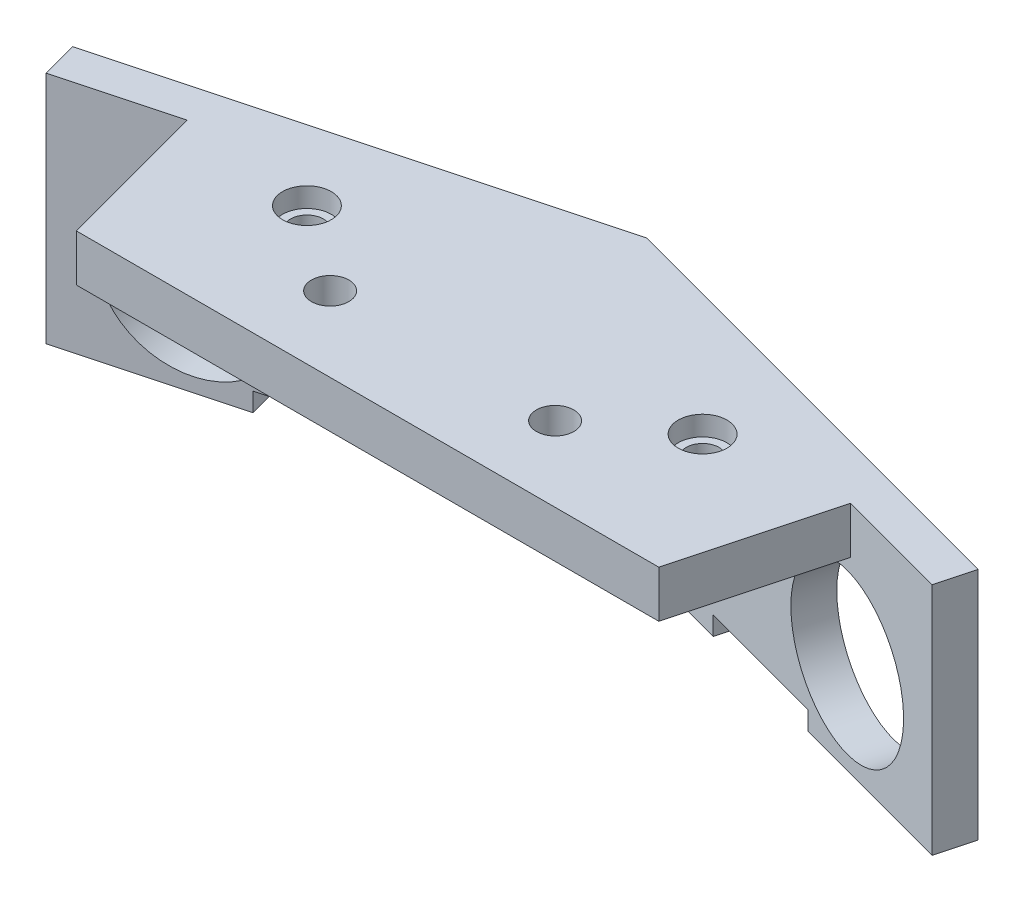
from build123d import *

# Parameters (mm, degrees)
BOSS_EXTRUDE1_DEPTH = 25
SKETCH2_R           = 2
BOSS_EXTRUDE2_DEPTH = 5
SKETCH3_R           = 1.75
CUT_EXTRUDE1_DEPTH  = 5
SKETCH4_R           = 2.6
CUT_EXTRUDE2_DEPTH  = 2.1
BOSS_EXTRUDE4_DEPTH = 1.5
SKETCH6_R           = 8.5
SKETCH6_W           = 11
SKETCH6_H           = 3
CUT_EXTRUDE3_DEPTH  = 62.991888409
SKETCH7_R           = 8.5
SKETCH7_W           = 11
SKETCH7_H           = 4
CUT_EXTRUDE4_DEPTH  = 62.991888409
CUT_EXTRUDE6_DEPTH  = 2
CUT_EXTRUDE7_DEPTH  = 3.5


with BuildPart() as part:
    # Sketch1 → Boss-Extrude1 (new body)
    with BuildSketch(Plane(origin=(0, 0, 0), x_dir=(1, 0, 0), z_dir=(0, 1, 0))):
        Polygon((0, 0), (-48.296291314, -12.940952255), (-47.261015134, -16.80465556), (0, -4.141104722), (47.261015134, -16.80465556), (48.296291314, -12.940952255), align=None)
    extrude(amount=BOSS_EXTRUDE1_DEPTH)

    # Sketch2 → Boss-Extrude2 (add)
    with BuildSketch(Plane(origin=(0, 25, 0), x_dir=(1, 0, 0), z_dir=(0, 1, 0))):
        Polygon((18.842355233, -29.75672149), (-18.842355233, -29.75672149), (-31.057618335, -29.75672149), (-35.381056589, -13.621430262), (0, -4.141104722), (35.381056589, -13.621430262), (31.057618335, -29.75672149), align=None)
        with Locations(Location((-12, -21.75672149, 0), (0, 0, 270))):
            Circle(SKETCH2_R, mode=Mode.SUBTRACT)
        with Locations(Location((12, -21.75672149, 0), (0, 0, 270))):
            Circle(SKETCH2_R, mode=Mode.SUBTRACT)
    extrude(amount=-BOSS_EXTRUDE2_DEPTH)

    # Sketch3 → Cut-Extrude1 (cut)
    with BuildSketch(Plane(origin=(0, 25, 0), x_dir=(1, 0, 0), z_dir=(0, 1, 0))):
        Polygon((24.5917878, -13.318644854), (23.220046861, -18.438051734), (25.345083679, -19.007453633), (26.716824618, -13.888046753), align=None)
        with Locations(Location((21.104732435, -15.127773063, 0), (0, 0, 270))):
            Circle(SKETCH3_R)
        Polygon((18.989418008, -11.817494393), (17.617677069, -16.936901272), (15.492640251, -16.367499373), (16.86438119, -11.248092493), align=None)
        Polygon((-15.492640251, -16.367499373), (-17.617677069, -16.936901272), (-18.989418008, -11.817494393), (-16.86438119, -11.248092493), align=None)
        with Locations(Location((-21.104732435, -15.127773063, 0), (0, 0, 270))):
            Circle(SKETCH3_R)
        Polygon((-25.345083679, -19.007453633), (-26.716824618, -13.888046753), (-24.5917878, -13.318644854), (-23.220046861, -18.438051734), align=None)
    extrude(amount=-CUT_EXTRUDE1_DEPTH, mode=Mode.SUBTRACT)

    # Sketch4 → Cut-Extrude2 (cut)
    with BuildSketch(Plane(origin=(0, 25, 0), x_dir=(1, 0, 0), z_dir=(0, 1, 0))):
        with Locations(Location((-21.104732435, -15.127773063, 0), (0, 0, 270))):
            Circle(SKETCH4_R)
        with Locations(Location((21.104732435, -15.127773063, 0), (0, 0, 270))):
            Circle(SKETCH4_R)
    extrude(amount=-CUT_EXTRUDE2_DEPTH, mode=Mode.SUBTRACT)

    # Sketch5 → Boss-Extrude4 (add)
    with BuildSketch(Plane(origin=(0, 25, 0), x_dir=(1, 0, 0), z_dir=(0, 1, 0))):
        Polygon((-26.716824618, -13.888046753), (-25.345083679, -19.007453633), (-23.220046861, -18.438051734), (-24.5917878, -13.318644854), align=None)
        Polygon((-17.617677069, -16.936901272), (-15.492640251, -16.367499373), (-16.86438119, -11.248092493), (-18.989418008, -11.817494393), align=None)
        Polygon((18.989418008, -11.817494393), (17.617677069, -16.936901272), (15.492640251, -16.367499373), (16.86438119, -11.248092493), align=None)
        Polygon((24.5917878, -13.318644854), (26.716824618, -13.888046753), (25.345083679, -19.007453633), (23.220046861, -18.438051734), align=None)
    extrude(amount=-BOSS_EXTRUDE4_DEPTH)

    # Sketch6 → Cut-Extrude3 (cut, through all)
    with BuildSketch(Plane(origin=(0, 0, 0), x_dir=(-0.9659258262890691, 0, 0.2588190451025181), z_dir=(-0.2588190451025181, 0, -0.9659258262890691))):
        with Locations((37.2, 10)):
            Circle(SKETCH6_R)
        with Locations((11.2, 10)):
            Circle(SKETCH6_R)
        with Locations((24.5, 17.7)):
            Rectangle(SKETCH6_W, SKETCH6_H)
    extrude(amount=-CUT_EXTRUDE3_DEPTH, mode=Mode.SUBTRACT)

    # Sketch7 → Cut-Extrude4 (cut, through all)
    with BuildSketch(Plane(origin=(0, 0, 0), x_dir=(-0.9659258262890691, 0, -0.2588190451025176), z_dir=(0.25881904510251763, 0, -0.9659258262890692))):
        with Locations((-10.82, 10)):
            Circle(SKETCH7_R)
        with Locations((-37.2, 10)):
            Circle(SKETCH7_R)
        with Locations((-24, 17.2)):
            Rectangle(SKETCH7_W, SKETCH7_H)
    extrude(amount=-CUT_EXTRUDE4_DEPTH, mode=Mode.SUBTRACT)

    # Sketch8 → Cut-Extrude6 (cut)
    with BuildSketch(Plane(origin=(0, 0, 0), x_dir=(-1, 0, 0), z_dir=(0, -1, 0))):
        Polygon((-29.167865413, -11.956610704), (-15.363800523, -8.257822665), (-16.010848136, -5.843008099), (-29.814913026, -9.541796138), align=None)
        Polygon((15.363800523, -8.257822665), (29.852687918, -12.140108341), (30.499735531, -9.725293775), (16.010848136, -5.843008099), align=None)
    extrude(amount=-CUT_EXTRUDE6_DEPTH, mode=Mode.SUBTRACT)

    # Sketch9 → Cut-Extrude7 (cut)
    with BuildSketch(Plane(origin=(0, 20, 0), x_dir=(-1, 0, 0), z_dir=(0, -1, 0))):
        Polygon((-25.086264634, -19.973379459), (-22.961227816, -19.40397756), (-23.220046861, -18.438051734), (-25.345083679, -19.007453633), align=None)
        Polygon((-15.492640251, -16.367499373), (-15.233821206, -17.333425199), (-17.358858024, -17.902827098), (-17.617677069, -16.936901272), align=None)
        Polygon((15.233821206, -17.333425199), (17.358858024, -17.902827098), (17.617677069, -16.936901272), (15.492640251, -16.367499373), align=None)
        Polygon((25.345083679, -19.007453633), (25.086264634, -19.973379459), (22.961227816, -19.40397756), (23.220046861, -18.438051734), align=None)
    extrude(amount=-CUT_EXTRUDE7_DEPTH, mode=Mode.SUBTRACT)


solid = part.part
